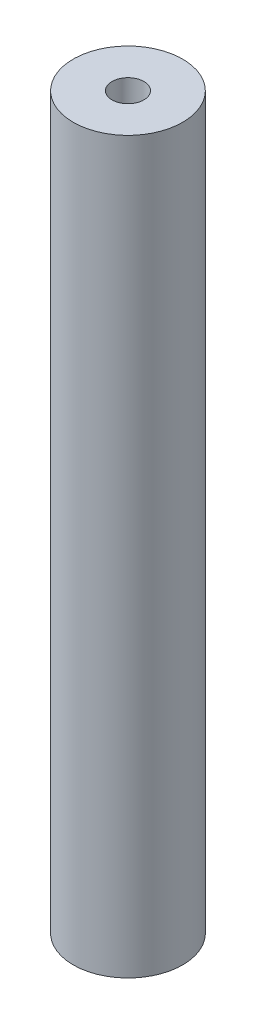
from build123d import *

# Parameters (mm, degrees)
SKETCH1_R           = 3
BOSS_EXTRUDE1_DEPTH = 40
SKETCH2_R           = 0.875
CUT_EXTRUDE1_DEPTH  = 41.224370722


with BuildPart() as part:
    # Sketch1 → Boss-Extrude1 (new body)
    with BuildSketch(Plane(origin=(0, 0, 0), x_dir=(1, 0, 0), z_dir=(0, 1, 0))):
        with Locations(Location((0, 0, 0), (0, 0, 270))):
            Circle(SKETCH1_R)
    extrude(amount=BOSS_EXTRUDE1_DEPTH)

    # Sketch2 → Cut-Extrude1 (cut, through all)
    with BuildSketch(Plane(origin=(0, 40, 0), x_dir=(1, 0, 0), z_dir=(0, 1, 0))):
        with Locations(Location((0, 0, 0), (0, 0, 270))):
            Circle(SKETCH2_R)
    extrude(amount=-CUT_EXTRUDE1_DEPTH, mode=Mode.SUBTRACT)


solid = part.part
